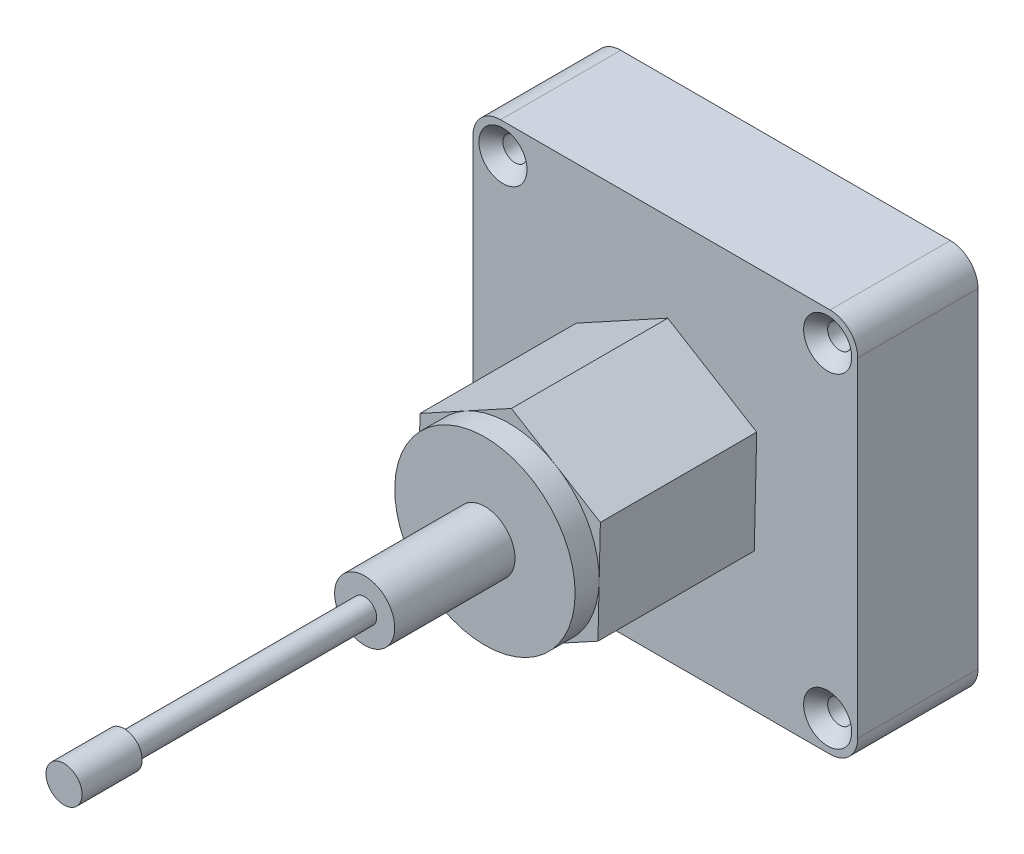
from build123d import *

# Parameters (mm, degrees)
BOSS_EXTRUDE1_DEPTH = 2
SKETCH2_R           = 7.5
BOSS_EXTRUDE2_DEPTH = 2
SKETCH3_R           = 2.5
BOSS_EXTRUDE3_DEPTH = 10
SKETCH4_R           = 1
BOSS_EXTRUDE4_DEPTH = 20
SKETCH5_R           = 1.5
BOSS_EXTRUDE5_DEPTH = 5
BOSS_EXTRUDE6_DEPTH = 11
SKETCH7_R           = 1
BOSS_EXTRUDE7_DEPTH = 10
CHAMFER1_SIZE       = 1


with BuildPart() as part:
    # Sketch1 → Boss-Extrude1 (new body)
    with BuildSketch(Plane.XY):
        Polygon((7.397125851, -4.5036129), (7.598806105, 4.154292452), (0.201680255, 8.657905351), (-7.397125851, 4.5036129), (-7.598806105, -4.154292452), (-0.201680255, -8.657905351), align=None)
    extrude(amount=-BOSS_EXTRUDE1_DEPTH)

    # Sketch2 → Boss-Extrude2 (add)
    with BuildSketch(Plane.XY):
        with Locations(Location((0, 0, 0), (0, 0, 178.665573541))):
            Circle(SKETCH2_R)
    extrude(amount=BOSS_EXTRUDE2_DEPTH)

    # Sketch3 → Boss-Extrude3 (add)
    with BuildSketch(Plane.XY.offset(2)):
        Circle(SKETCH3_R)
    extrude(amount=BOSS_EXTRUDE3_DEPTH)

    # Sketch4 → Boss-Extrude4 (add)
    with BuildSketch(Plane.XY.offset(12)):
        Circle(SKETCH4_R)
    extrude(amount=BOSS_EXTRUDE4_DEPTH)

    # Sketch5 → Boss-Extrude5 (add)
    with BuildSketch(Plane.XY.offset(32)):
        Circle(SKETCH5_R)
    extrude(amount=BOSS_EXTRUDE5_DEPTH)

    # Sketch6 → Boss-Extrude6 (add)
    with BuildSketch(Plane(origin=(0, 0, -2), x_dir=(-1, 0, 0), z_dir=(0, 0, -1))):
        Polygon((-7.598806105, 4.154292452), (-0.201680255, 8.657905351), (7.397125851, 4.5036129), (7.598806105, -4.154292452), (0.201680255, -8.657905351), (-7.397125851, -4.5036129), align=None)
    extrude(amount=BOSS_EXTRUDE6_DEPTH)

    # Sketch7 → Boss-Extrude7 (add)
    with BuildSketch(Plane(origin=(0, 0, -13), x_dir=(-1, 0, 0), z_dir=(0, 0, -1))):
        with BuildLine():
            Line((-13.7, 16), (13.7, 16))
            ThreePointArc((13.7, 16), (15.326345597, 15.326345597), (16, 13.7))
            Line((16, 13.7), (16, -13.7))
            ThreePointArc((16, -13.7), (15.326345597, -15.326345597), (13.7, -16))
            Line((13.7, -16), (-13.7, -16))
            ThreePointArc((-13.7, -16), (-15.326345597, -15.326345597), (-16, -13.7))
            Line((-16, -13.7), (-16, 13.7))
            ThreePointArc((-16, 13.7), (-15.326345597, 15.326345597), (-13.7, 16))
        make_face()
        with Locations((-13.5, 13.5)):
            Circle(SKETCH7_R, mode=Mode.SUBTRACT)
        with Locations((13.5, 13.5)):
            Circle(SKETCH7_R, mode=Mode.SUBTRACT)
        with Locations((13.5, -13.5)):
            Circle(SKETCH7_R, mode=Mode.SUBTRACT)
        with Locations((-13.5, -13.5)):
            Circle(SKETCH7_R, mode=Mode.SUBTRACT)
    extrude(amount=BOSS_EXTRUDE7_DEPTH)

    # Chamfer1
    chamfer1_edges = [part.edges().sort_by_distance(p)[0] for p in [
        (-12.5, -13.5, -13),
        (14.5, 13.5, -13),
        (-12.5, 13.5, -13),
        (14.5, -13.5, -13),
    ]]
    chamfer(chamfer1_edges, length=CHAMFER1_SIZE)


solid = part.part
